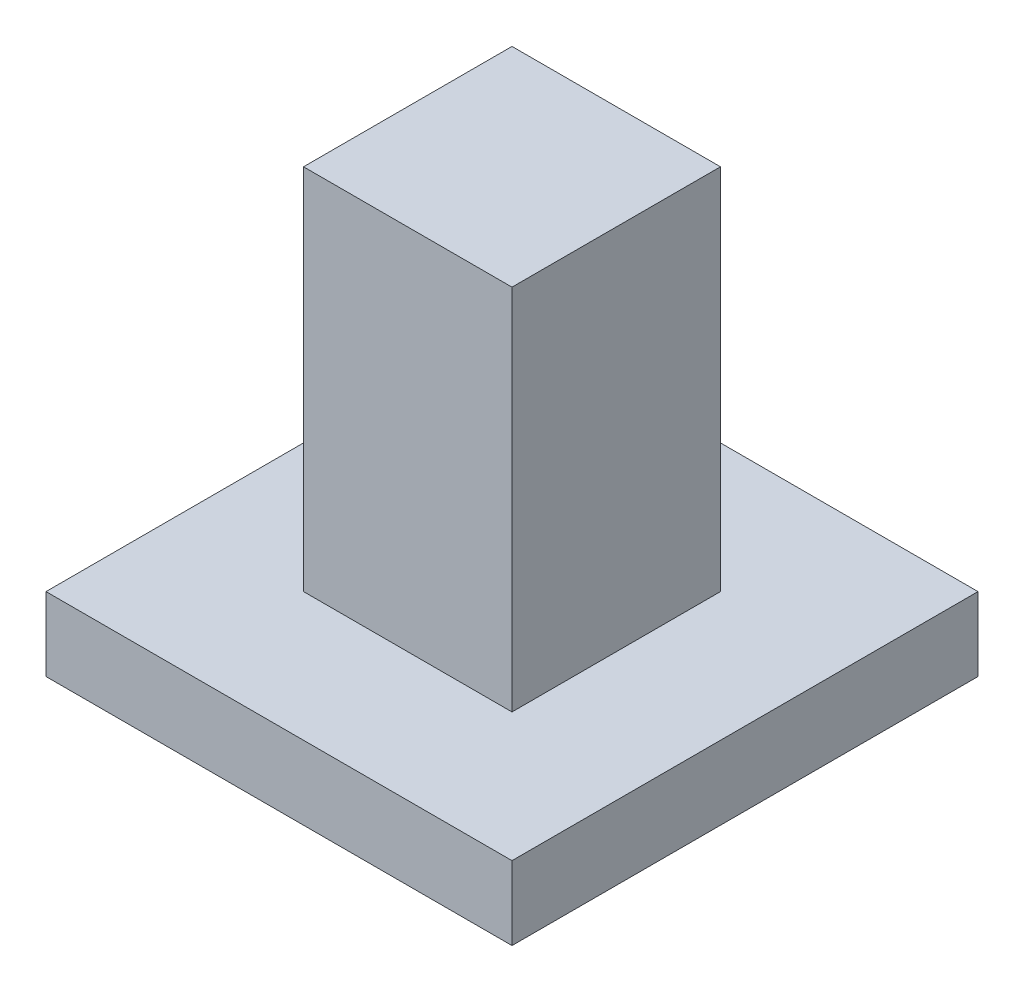
from build123d import *

# Parameters (mm, degrees)
SKETCH_1_W      = 7.6
SKETCH_1_H      = 7.6
EXTRUDE_1_DEPTH = 1.2
SKETCH_2_W      = 3.4
SKETCH_2_H      = 3.4
EXTRUDE_2_DEPTH = 6


with BuildPart() as part:
    # 草图1 → 凸台-拉伸1 (new body)
    with BuildSketch(Plane(origin=(0, 0, 0), x_dir=(1, 0, 0), z_dir=(0, 1, 0))):
        with Locations((-3.8, 3.8)):
            Rectangle(SKETCH_1_W, SKETCH_1_H)
    extrude(amount=EXTRUDE_1_DEPTH)

    # 草图2 → 凸台-拉伸2 (add)
    with BuildSketch(Plane(origin=(0, 1.2, 0), x_dir=(1, 0, 0), z_dir=(0, 1, 0))):
        with Locations((-3.8, 3.8)):
            Rectangle(SKETCH_2_W, SKETCH_2_H)
    extrude(amount=EXTRUDE_2_DEPTH)


solid = part.part
